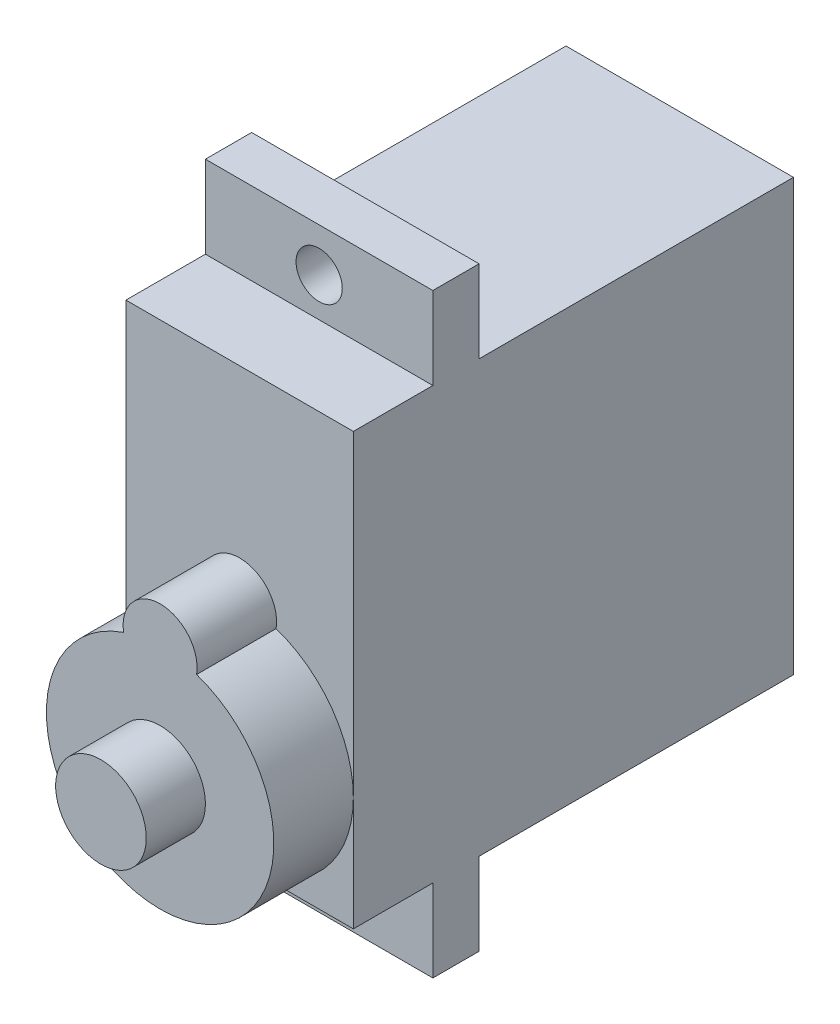
from build123d import *

# Parameters (mm, degrees)
ESQUISSE1_W        = 12.3
ESQUISSE1_H        = 23.3
BOSS_EXTRU_1_DEPTH = 17
ESQUISSE2_W        = 12.3
ESQUISSE2_H        = 32.2
ESQUISSE2_R        = 1.25
BOSS_EXTRU_2_DEPTH = 2.5
ESQUISSE3_W        = 12.3
ESQUISSE3_H        = 23.3
BOSS_EXTRU_3_DEPTH = 4.3
BOSS_EXTRU_4_DEPTH = 4.3
ESQUISSE5_R        = 2.45
BOSS_EXTRU_5_DEPTH = 3.2


with BuildPart() as part:
    # Esquisse1 → Boss.-Extru.1 (new body)
    with BuildSketch(Plane.XY):
        with Locations((6.15, 11.65)):
            Rectangle(ESQUISSE1_W, ESQUISSE1_H)
    extrude(amount=BOSS_EXTRU_1_DEPTH)

    # Esquisse2 → Boss.-Extru.2 (add)
    with BuildSketch(Plane.XY.offset(17)):
        with Locations((6.15, 11.65)):
            Rectangle(ESQUISSE2_W, ESQUISSE2_H)
        with Locations((6.15, 25.4)):
            Circle(ESQUISSE2_R, mode=Mode.SUBTRACT)
        with Locations(Location((6.15, -2.1, 0), (0, 0, 180))):
            Circle(ESQUISSE2_R, mode=Mode.SUBTRACT)
    extrude(amount=BOSS_EXTRU_2_DEPTH)

    # Esquisse3 → Boss.-Extru.3 (add)
    with BuildSketch(Plane.XY.offset(19.5)):
        with Locations((6.15, 11.65)):
            Rectangle(ESQUISSE3_W, ESQUISSE3_H)
    extrude(amount=BOSS_EXTRU_3_DEPTH)

    # Esquisse4 → Boss.-Extru.4 (add)
    with BuildSketch(Plane.XY.offset(23.8)):
        with BuildLine():
            ThreePointArc((4.176616397, 11.974796748), (6.15, 0), (8.123383603, 11.974796748))
            ThreePointArc((8.123383603, 11.974796748), (6.15, 14.3), (4.176616397, 11.974796748))
        make_face()
    extrude(amount=BOSS_EXTRU_4_DEPTH)

    # Esquisse5 → Boss.-Extru.5 (add)
    with BuildSketch(Plane.XY.offset(28.1)):
        with Locations((6.15, 6.15)):
            Circle(ESQUISSE5_R)
    extrude(amount=BOSS_EXTRU_5_DEPTH)


solid = part.part
